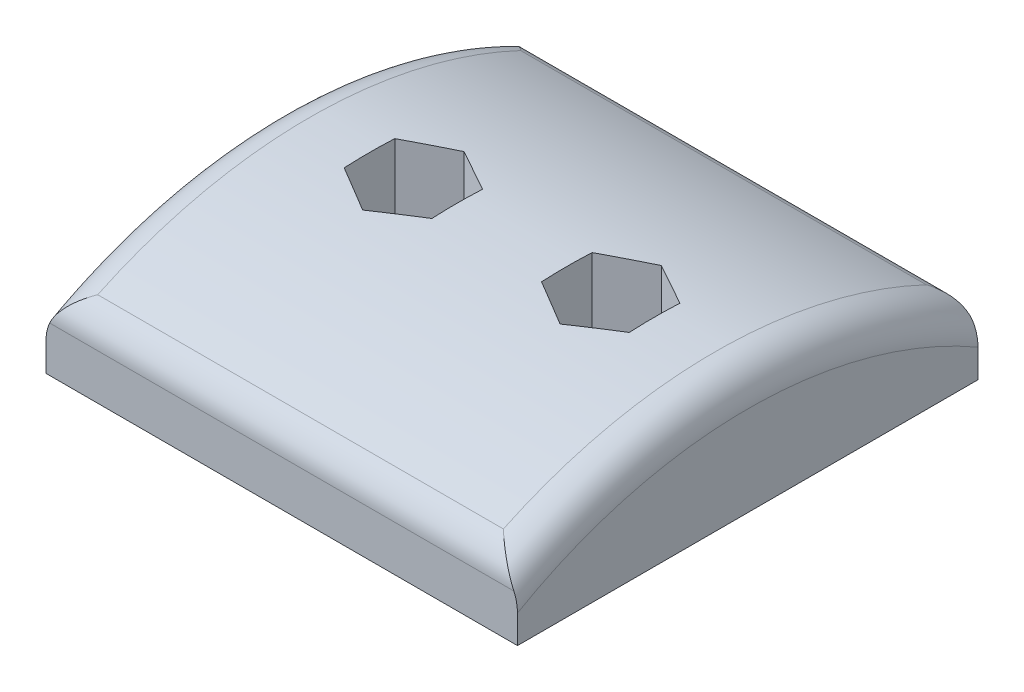
from build123d import *

# Parameters (mm, degrees)
BOSS_EXTRUDE1_DEPTH = 21.5
FILLET1_R           = 3
CUT_EXTRUDE1_START  = -4
CUT_EXTRUDE1_DEPTH  = 29.073373183
SKETCH4_R           = 2.5
CUT_EXTRUDE2_DEPTH  = 4


with BuildPart() as part:
    # Sketch2 → Boss-Extrude1 (new, symmetric)
    with BuildSketch(Plane(origin=(0, 0, 0), x_dir=(0, 0, -1), z_dir=(1, 0, 0))):
        with BuildLine():
            Line((-21, 6), (-21, 0))
            Line((-21, 0), (21, 0))
            Line((21, 0), (21, 6))
            ThreePointArc((21, 6), (0, 11.200502516), (-21, 6))
        make_face()
    extrude(amount=BOSS_EXTRUDE1_DEPTH, both=True)

    # Fillet1
    fillet1_edges = [part.edges().sort_by_distance(p)[0] for p in [
        (21.5, 11.200502516, 0),
        (-21.5, 11.200502516, 0),
        (0, 6, -21),
        (0, 6, 21),
    ]]
    fillet(fillet1_edges, radius=FILLET1_R)

    # Sketch3 → Cut-Extrude1 (cut, through all)
    with BuildSketch(Plane.XZ.offset(CUT_EXTRUDE1_START)):
        Polygon((5, 2.309401077), (5, -2.309401077), (9, -4.618802154), (13, -2.309401077), (13, 2.309401077), (9, 4.618802154), align=None)
        Polygon((-9, 4.618802154), (-5, 2.309401077), (-5, -2.309401077), (-9, -4.618802154), (-13, -2.309401077), (-13, 2.309401077), align=None)
    extrude(amount=-CUT_EXTRUDE1_DEPTH, mode=Mode.SUBTRACT)

    # Sketch4 → Cut-Extrude2 (cut)
    with BuildSketch(Plane.XZ):
        with Locations(Location((9, 0, 0), (0, 0, 270))):
            Circle(SKETCH4_R)
        with Locations(Location((-9, 0, 0), (0, 0, 270))):
            Circle(SKETCH4_R)
    extrude(amount=-CUT_EXTRUDE2_DEPTH, mode=Mode.SUBTRACT)


solid = part.part
